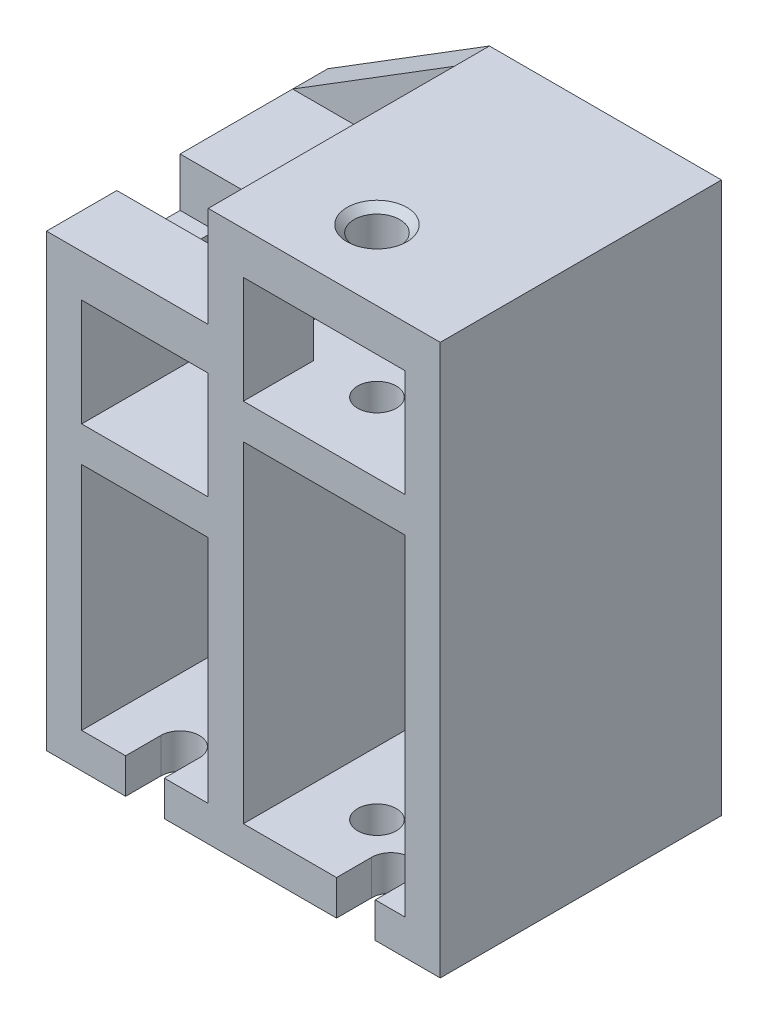
from build123d import *

# Parameters (mm, degrees)
SKETCH1_W           = 18
SKETCH1_H           = 32.75
SKETCH1_W_2         = 23
SKETCH1_H_2         = 15.25
SKETCH1_H_3         = 47.05
BOSS_EXTRUDE1_DEPTH = 40
CUT_EXTRUDE1_REACH  = 106.244
SKETCH2_R           = 2.75
CUT_EXTRUDE2_REACH  = 94.276
SKETCH3_W           = 9
SKETCH3_H           = 15.25
SKETCH4_W           = 10
SKETCH4_H           = 15.25
CUT_EXTRUDE3_DEPTH  = 102.645904984
CUT_EXTRUDE4_REACH  = 106.244
SKETCH6_R           = 3.25
CHAMFER1_SIZE       = 1
CUT_EXTRUDE5_REACH  = 106.244
SKETCH7_R           = 3.3
SKETCH8_R           = 2.75
CUT_EXTRUDE6_DEPTH  = 101.542975886
SKETCH9_W           = 23
SKETCH9_H           = 25
SKETCH9_W_2         = 18
SKETCH9_H_2         = 10.7
BOSS_EXTRUDE2_DEPTH = 5


with BuildPart() as part:
    # Sketch1 → Boss-Extrude1 (new body)
    with BuildSketch(Plane.XY):
        Polygon((0, 0), (0, 64), (23, 64), (23, 78.3), (56, 78.3), (56, 0), align=None)
        with Locations((14, 21.375)):
            Rectangle(SKETCH1_W, SKETCH1_H, mode=Mode.SUBTRACT)
        with Locations((39.5, 64.675)):
            Rectangle(SKETCH1_W_2, SKETCH1_H_2, mode=Mode.SUBTRACT)
        with Locations((14, 50.375)):
            Rectangle(SKETCH1_W, SKETCH1_H_2, mode=Mode.SUBTRACT)
        with Locations((39.5, 28.525)):
            Rectangle(SKETCH1_W_2, SKETCH1_H_3, mode=Mode.SUBTRACT)
    extrude(amount=BOSS_EXTRUDE1_DEPTH)

    # Cut-Extrude1: up to this face of the body (flat: up to its plane)
    cut_extrude1_end = Plane(part.part.faces().sort_by_distance((14, 37.75, 20))[0])
    # Sketch2 → Cut-Extrude1 (cut, up to the picked face)
    with BuildSketch(Plane(origin=(0, 78.3, 0), x_dir=(1, 0, 0), z_dir=(0, 1, 0)), mode=Mode.PRIVATE) as cut_extrude1_sk1:
        with Locations(Location((14, -15, 0), (0, 0, 180))):
            Circle(SKETCH2_R)
    cut_extrude1_tool1 = split(extrude(cut_extrude1_sk1.sketch, amount=-CUT_EXTRUDE1_REACH, mode=Mode.PRIVATE), bisect_by=cut_extrude1_end, keep=Keep.BOTH, mode=Mode.PRIVATE)
    # Sketch2 → Cut-Extrude1 (cut, up to the picked face)
    with BuildSketch(Plane(origin=(0, 78.3, 0), x_dir=(1, 0, 0), z_dir=(0, 1, 0)), mode=Mode.PRIVATE) as cut_extrude1_sk2:
        with Locations(Location((37, -30, 0), (0, 0, 180))):
            Circle(SKETCH2_R)
    cut_extrude1_tool2 = split(extrude(cut_extrude1_sk2.sketch, amount=-CUT_EXTRUDE1_REACH, mode=Mode.PRIVATE), bisect_by=cut_extrude1_end, keep=Keep.BOTH, mode=Mode.PRIVATE)
    add(cut_extrude1_tool1.solids().sort_by(Axis((14, 78.3, 15), (0, -1, 0)))[0], mode=Mode.SUBTRACT)
    add(cut_extrude1_tool2.solids().sort_by(Axis((37, 78.3, 30), (0, -1, 0)))[0], mode=Mode.SUBTRACT)

    # Sketch3 → Cut-Extrude2 (cut, up to next)
    with BuildSketch(Plane(origin=(28, 0, 0), x_dir=(0, 0, -1), z_dir=(1, 0, 0)), mode=Mode.PRIVATE) as cut_extrude2_sk1:
        with Locations((-25.5, 64.675)):
            Rectangle(SKETCH3_W, SKETCH3_H)
    cut_extrude2_tool1 = extrude(cut_extrude2_sk1.sketch, amount=-CUT_EXTRUDE2_REACH, mode=Mode.PRIVATE) & part.part
    add(cut_extrude2_tool1.solids().sort_by_distance((28, 64.675, 25.5))[0], mode=Mode.SUBTRACT)

    # Sketch4 → Cut-Extrude3 (cut, through all)
    with BuildSketch(Plane(origin=(5, 0, 0), x_dir=(0, 0, -1), z_dir=(1, 0, 0))):
        with Locations((-10, 50.375)):
            Rectangle(SKETCH4_W, SKETCH4_H)
    extrude(amount=-CUT_EXTRUDE3_DEPTH, mode=Mode.SUBTRACT)

    # Sketch6 → Cut-Extrude4 (cut, up to next)
    with BuildSketch(Plane(origin=(0, 78.3, 0), x_dir=(1, 0, 0), z_dir=(0, 1, 0)), mode=Mode.PRIVATE) as cut_extrude4_sk1:
        with Locations(Location((14, -15, 0), (0, 0, 270))):
            Circle(SKETCH6_R)
    cut_extrude4_tool1 = extrude(cut_extrude4_sk1.sketch, amount=-CUT_EXTRUDE4_REACH, mode=Mode.PRIVATE) & part.part
    # Sketch6 → Cut-Extrude4 (cut, up to next)
    with BuildSketch(Plane(origin=(0, 78.3, 0), x_dir=(1, 0, 0), z_dir=(0, 1, 0)), mode=Mode.PRIVATE) as cut_extrude4_sk2:
        with Locations(Location((37, -30, 0), (0, 0, 270))):
            Circle(SKETCH6_R)
    cut_extrude4_tool2 = extrude(cut_extrude4_sk2.sketch, amount=-CUT_EXTRUDE4_REACH, mode=Mode.PRIVATE) & part.part
    add(cut_extrude4_tool1.solids().sort_by_distance((14, 78.3, 15))[0], mode=Mode.SUBTRACT)
    add(cut_extrude4_tool2.solids().sort_by_distance((37, 78.3, 30))[0], mode=Mode.SUBTRACT)

    # Chamfer1
    chamfer1_edges = [part.edges().sort_by_distance(p)[0] for p in [
        (14, 64, 11.75),
        (37, 78.3, 26.75),
    ]]
    chamfer(chamfer1_edges, length=CHAMFER1_SIZE)

    # Sketch7 → Cut-Extrude5 (cut, up to next)
    with BuildSketch(Plane.XZ, mode=Mode.PRIVATE) as cut_extrude5_sk1:
        with Locations((14, 15)):
            Circle(SKETCH7_R)
    cut_extrude5_tool1 = extrude(cut_extrude5_sk1.sketch, amount=-CUT_EXTRUDE5_REACH, mode=Mode.PRIVATE) & part.part
    # Sketch7 → Cut-Extrude5 (cut, up to next)
    with BuildSketch(Plane.XZ, mode=Mode.PRIVATE) as cut_extrude5_sk2:
        with Locations((44, 15)):
            Circle(SKETCH7_R)
    cut_extrude5_tool2 = extrude(cut_extrude5_sk2.sketch, amount=-CUT_EXTRUDE5_REACH, mode=Mode.PRIVATE) & part.part
    # Sketch7 → Cut-Extrude5 (cut, up to next)
    with BuildSketch(Plane.XZ, mode=Mode.PRIVATE) as cut_extrude5_sk3:
        with BuildLine():
            Line((11.25, 35), (11.25, 40))
            Line((11.25, 40), (16.75, 40))
            Line((16.75, 40), (16.75, 35))
            ThreePointArc((16.75, 35), (14, 32.25), (11.25, 35))
        make_face()
    cut_extrude5_tool3 = extrude(cut_extrude5_sk3.sketch, amount=-CUT_EXTRUDE5_REACH, mode=Mode.PRIVATE) & part.part
    # Sketch7 → Cut-Extrude5 (cut, up to next)
    with BuildSketch(Plane.XZ, mode=Mode.PRIVATE) as cut_extrude5_sk4:
        with BuildLine():
            Line((41.25, 35), (41.25, 40))
            Line((41.25, 40), (46.75, 40))
            Line((46.75, 40), (46.75, 35))
            ThreePointArc((46.75, 35), (44, 32.25), (41.25, 35))
        make_face()
    cut_extrude5_tool4 = extrude(cut_extrude5_sk4.sketch, amount=-CUT_EXTRUDE5_REACH, mode=Mode.PRIVATE) & part.part
    add(cut_extrude5_tool1.solids().sort_by_distance((14, 0, 15))[0], mode=Mode.SUBTRACT)
    add(cut_extrude5_tool2.solids().sort_by_distance((44, 0, 15))[0], mode=Mode.SUBTRACT)
    add(cut_extrude5_tool3.solids().sort_by_distance((14, 0, 36.393769))[0], mode=Mode.SUBTRACT)
    add(cut_extrude5_tool4.solids().sort_by_distance((44, 0, 36.393769))[0], mode=Mode.SUBTRACT)

    # Sketch8 → Cut-Extrude6 (cut, through all)
    with BuildSketch(Plane(origin=(0, 5, 0), x_dir=(1, 0, 0), z_dir=(0, 1, 0))):
        with Locations(Location((37, -30, 0), (0, 0, 180))):
            Circle(SKETCH8_R)
    extrude(amount=-CUT_EXTRUDE6_DEPTH, mode=Mode.SUBTRACT)

    # Sketch9 → Boss-Extrude2 (add)
    with BuildSketch(Plane(origin=(0, 0, 0), x_dir=(-1, 0, 0), z_dir=(0, 0, -1))):
        Polygon((-23, 78.3), (0, 64), (-23, 64), align=None)
        with Locations((-39.5, 39.55)):
            Rectangle(SKETCH9_W, SKETCH9_H)
        with Locations((-14, 32.4)):
            Rectangle(SKETCH9_W_2, SKETCH9_H_2)
    extrude(amount=-BOSS_EXTRUDE2_DEPTH)


solid = part.part
